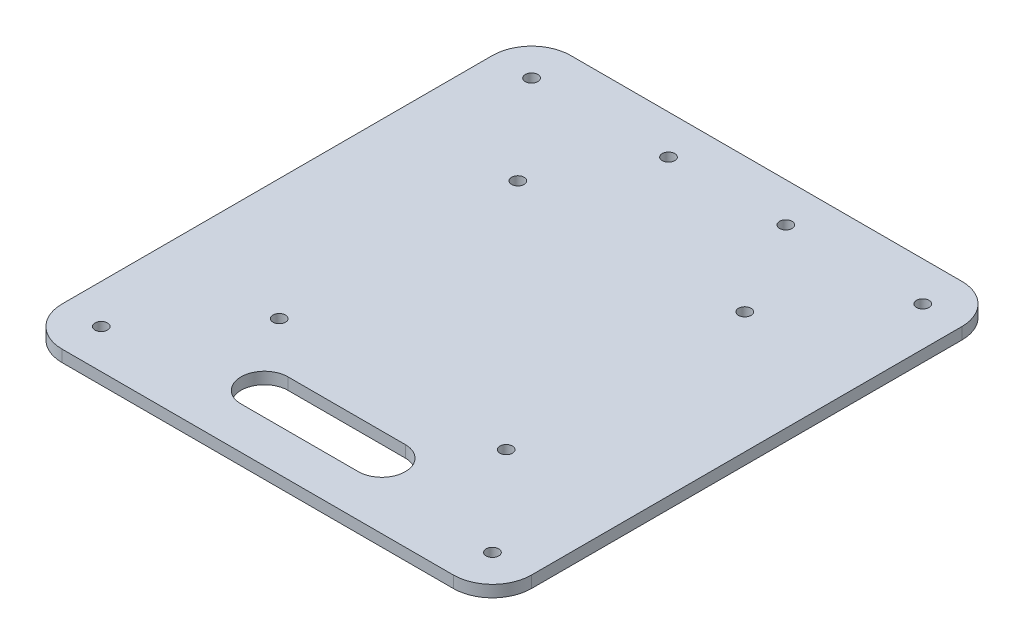
from build123d import *

# Parameters (mm, degrees)
SKETCH1_R           = 1.6
BOSS_EXTRUDE1_DEPTH = 3
SKETCH2_R           = 1.6
CUT_EXTRUDE1_DEPTH  = 45
SKETCH3_R           = 1.6
CUT_EXTRUDE2_DEPTH  = 89.509886453


with BuildPart() as part:
    # Sketch1 → Boss-Extrude1 (new body)
    with BuildSketch(Plane(origin=(0, 0, 0), x_dir=(1, 0, 0), z_dir=(0, 1, 0))):
        with BuildLine():
            Line((-50, 65), (50, 65))
            ThreePointArc((50, 65), (57.071067812, 62.071067812), (60, 55))
            Line((60, 55), (60, -55))
            ThreePointArc((60, -55), (57.071067812, -62.071067812), (50, -65))
            Line((50, -65), (-50, -65))
            ThreePointArc((-50, -65), (-57.071067812, -62.071067812), (-60, -55))
            Line((-60, -55), (-60, 55))
            ThreePointArc((-60, 55), (-57.071067812, 62.071067812), (-50, 65))
        make_face()
        with Locations(Location((50, -55, 0), (0, 0, 90))):
            Circle(SKETCH1_R, mode=Mode.SUBTRACT)
        with Locations(Location((50, 55, 0), (0, 0, 270))):
            Circle(SKETCH1_R, mode=Mode.SUBTRACT)
        with Locations(Location((-50, -55, 0), (0, 0, 270))):
            Circle(SKETCH1_R, mode=Mode.SUBTRACT)
        with Locations(Location((-50, 55, 0), (0, 0, 90))):
            Circle(SKETCH1_R, mode=Mode.SUBTRACT)
        with BuildLine():
            Line((-15, -42.267985155), (15, -42.267985155))
            ThreePointArc((15, -42.267985155), (21, -48.267985155), (15, -54.267985155))
            Line((15, -54.267985155), (-15, -54.267985155))
            ThreePointArc((-15, -54.267985155), (-21, -48.267985155), (-15, -42.267985155))
        make_face(mode=Mode.SUBTRACT)
    extrude(amount=BOSS_EXTRUDE1_DEPTH)

    # Sketch2 → Cut-Extrude1 (cut)
    with BuildSketch(Plane(origin=(0, 0, 0), x_dir=(1, 0, 0), z_dir=(0, 1, 0))):
        with Locations(Location((29, 30.5, 0), (0, 0, 90))):
            Circle(SKETCH2_R)
        with Locations(Location((-29, 30.5, 0), (0, 0, 90))):
            Circle(SKETCH2_R)
        with Locations(Location((29, -30.5, 0), (0, 0, 90))):
            Circle(SKETCH2_R)
        with Locations(Location((-29, -30.5, 0), (0, 0, 90))):
            Circle(SKETCH2_R)
    extrude(amount=CUT_EXTRUDE1_DEPTH, mode=Mode.SUBTRACT)

    # Sketch3 → Cut-Extrude2 (cut, through all)
    with BuildSketch(Plane(origin=(0, 3, 0), x_dir=(1, 0, 0), z_dir=(0, 1, 0))):
        with Locations(Location((-15, 55, 0), (0, 0, 270))):
            Circle(SKETCH3_R)
        with Locations(Location((15, 55, 0), (0, 0, 270))):
            Circle(SKETCH3_R)
    extrude(amount=-CUT_EXTRUDE2_DEPTH, mode=Mode.SUBTRACT)


solid = part.part
